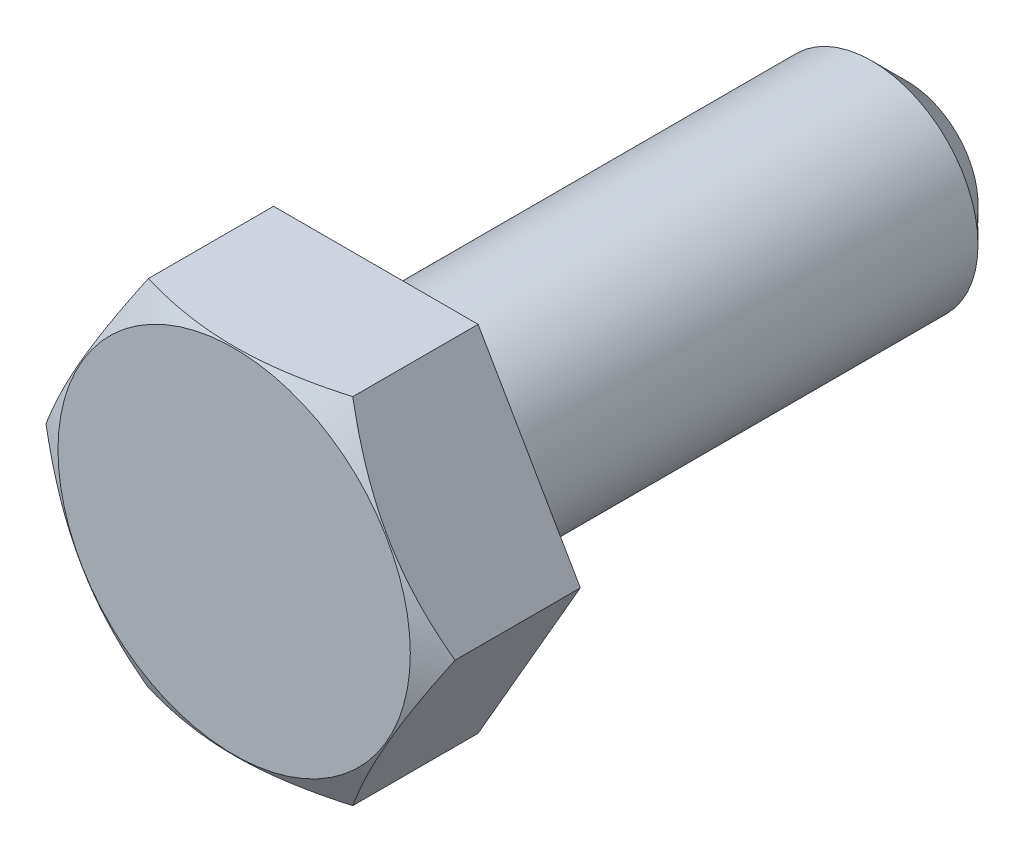
from build123d import *

# Parameters (mm, degrees)
EXTRUDE_1_DEPTH = 4
SKETCH_2_R      = 3
EXTRUDE_2_DEPTH = 15
CHAMFER_1_SIZE  = 1


with BuildPart() as part:
    # Эскиз1 → Бобышка-Вытянуть1 (new body)
    with BuildSketch(Plane.XY):
        Polygon((5.773502692, 0), (2.886751346, 5), (-2.886751346, 5), (-5.773502692, 0), (-2.886751346, -5), (2.886751346, -5), align=None)
    extrude(amount=EXTRUDE_1_DEPTH)

    # Эскиз2 → Бобышка-Вытянуть2 (add)
    with BuildSketch(Plane(origin=(0, 0, 0), x_dir=(-1, 0, 0), z_dir=(0, 0, -1))):
        with Locations(Location((0, 0, 0), (0, 0, 180))):
            Circle(SKETCH_2_R)
    extrude(amount=EXTRUDE_2_DEPTH)

    # Фаска1
    chamfer_1_edges = [part.edges().sort_by_distance(p)[0] for p in [
        (-3, 0, -15),
    ]]
    chamfer(chamfer_1_edges, length=CHAMFER_1_SIZE)

    # Эскиз3 → Вырез-Повернуть1 (revolve, cut)
    with BuildSketch(Plane(origin=(0, 0, 0), x_dir=(1, 0, 0), z_dir=(0, 1, 0))):
        Polygon((-10.773502692, -0.651368439), (-4.973502692, -4), (-10.773502692, -4), align=None)
    revolve(axis=Axis((0, 0, 4), (0, 0, -1)), mode=Mode.SUBTRACT)


solid = part.part
